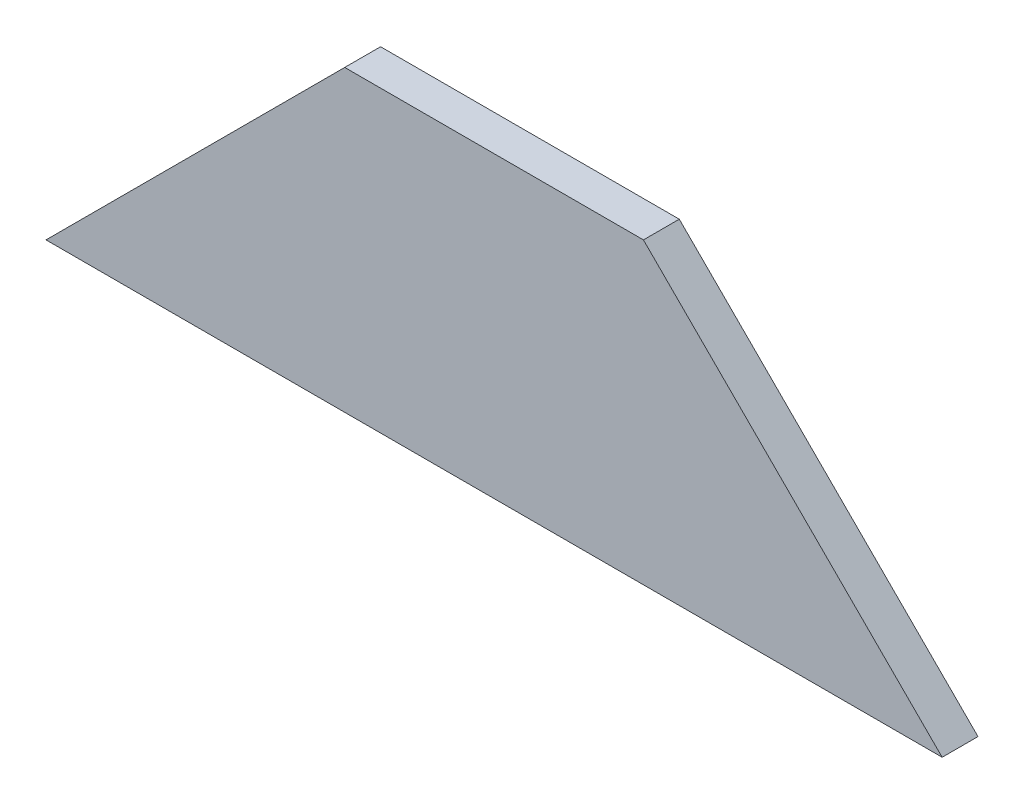
from build123d import *

# Parameters (mm, degrees)
EXTRUDE1_DEPTH = 6


with BuildPart() as part:
    # Sketch1 → Extrude1 (new body)
    with BuildSketch(Plane.XY):
        Polygon((0, 0), (-50, 50), (-100, 50), (-150, 0), align=None)
    extrude(amount=EXTRUDE1_DEPTH)


solid = part.part
